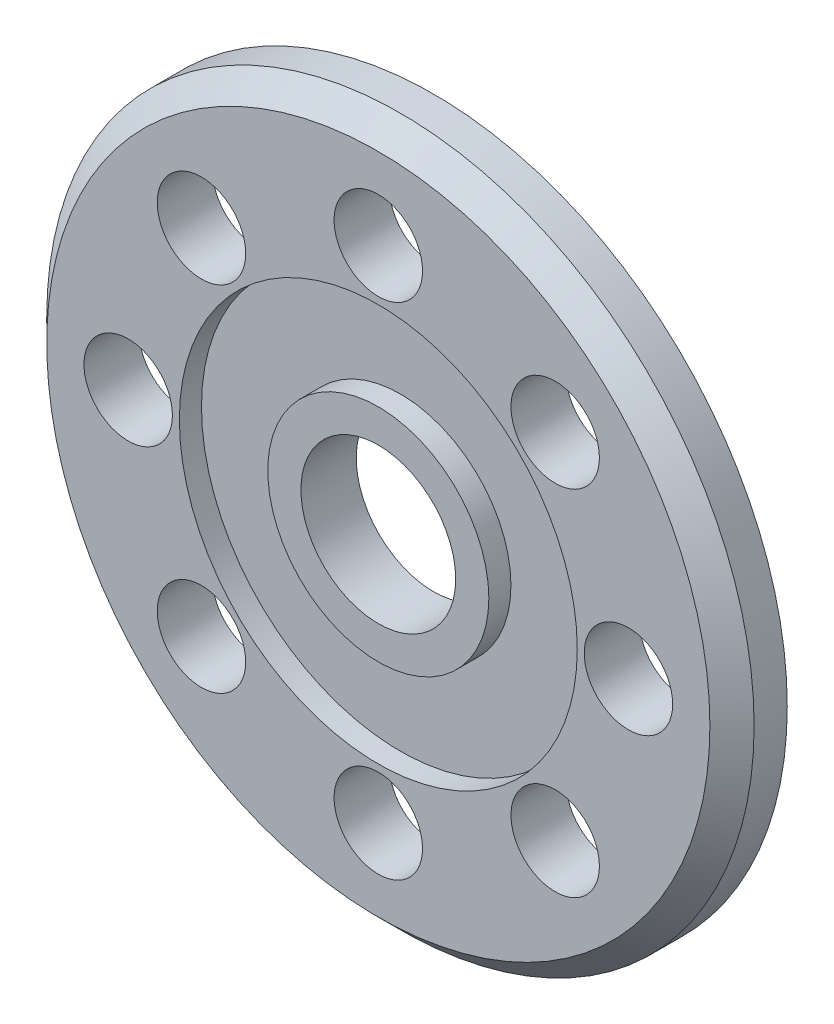
from build123d import *

# Parameters (mm, degrees)
SKETCH1_R           = 16
SKETCH1_R_2         = 2
SKETCH1_R_3         = 3.5
BOSS_EXTRUDE1_DEPTH = 2.5
SKETCH2_R           = 9
SKETCH2_R_2         = 5
CUT_EXTRUDE1_DEPTH  = 1
CHAMFER1_SIZE       = 1


with BuildPart() as part:
    # Sketch1 → Boss-Extrude1 (new body)
    with BuildSketch(Plane.XY):
        Circle(SKETCH1_R)
        with Locations((0, 11.315)):
            Circle(SKETCH1_R_2, mode=Mode.SUBTRACT)
        with Locations((8.000913229, 8.000913229)):
            Circle(SKETCH1_R_2, mode=Mode.SUBTRACT)
        with Locations((11.315, 0)):
            Circle(SKETCH1_R_2, mode=Mode.SUBTRACT)
        with Locations((8.000913229, -8.000913229)):
            Circle(SKETCH1_R_2, mode=Mode.SUBTRACT)
        with Locations((0, -11.315)):
            Circle(SKETCH1_R_2, mode=Mode.SUBTRACT)
        with Locations((-8.000913229, -8.000913229)):
            Circle(SKETCH1_R_2, mode=Mode.SUBTRACT)
        with Locations((-11.315, 0)):
            Circle(SKETCH1_R_2, mode=Mode.SUBTRACT)
        with Locations((-8.000913229, 8.000913229)):
            Circle(SKETCH1_R_2, mode=Mode.SUBTRACT)
        Circle(SKETCH1_R_3, mode=Mode.SUBTRACT)
    extrude(amount=BOSS_EXTRUDE1_DEPTH)

    # Sketch2 → Cut-Extrude1 (cut)
    with BuildSketch(Plane.XY.offset(2.5)):
        Circle(SKETCH2_R)
        Circle(SKETCH2_R_2, mode=Mode.SUBTRACT)
    extrude(amount=-CUT_EXTRUDE1_DEPTH, mode=Mode.SUBTRACT)

    # Chamfer1
    chamfer1_edges = [part.edges().sort_by_distance(p)[0] for p in [
        (-16, 0, 2.5),
    ]]
    chamfer(chamfer1_edges, length=CHAMFER1_SIZE)


solid = part.part
